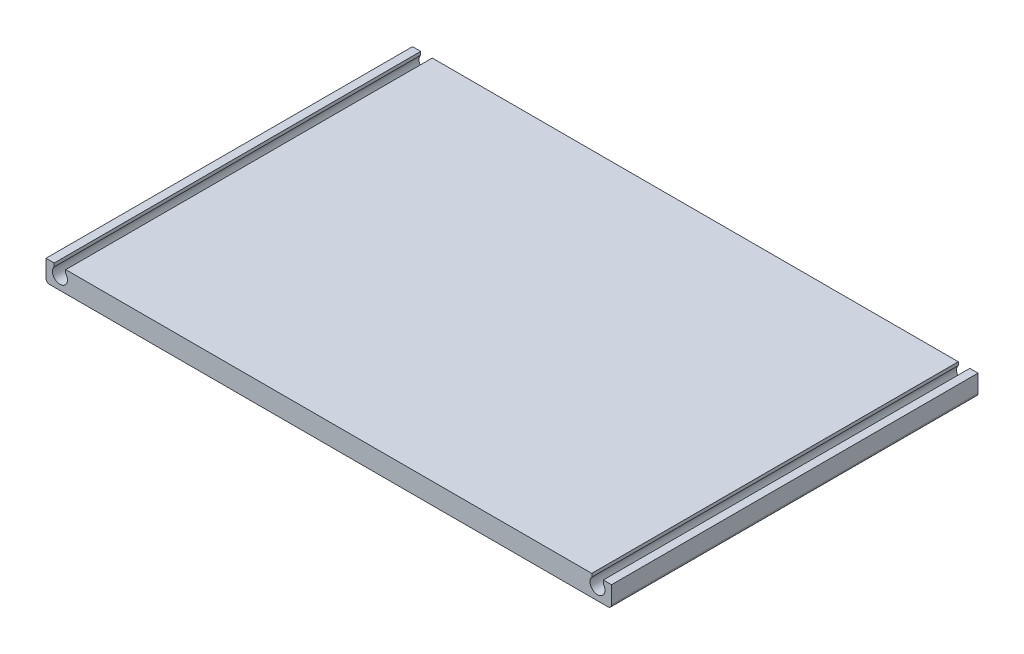
from build123d import *

# Parameters (mm, degrees)
SKETCH_1_W            = 162
SKETCH_1_H            = 105
EXTRUDE_1_DEPTH       = 6
CUT_EXTRUDE_1_DEPTH   = 133.747881339
FILLET_1_R            = 1
EXTRUDE_START         = -20
SKETCH_4_W            = 20
SKETCH_4_H            = 14.5
EXTRUDE_2_DEPTH       = 5
F_4_0MM_1_D           = 4
F_4_0MM_1_CSINK_D     = 4.05
F_4_0MM_1_CSINK_ANGLE = 90
EXTRUDE_START_2       = 15
SKETCH_7_W            = 6
SKETCH_7_H            = 9
EXTRUDE_3_DEPTH       = 20.5
SKETCH_8_R            = 1.5
CUT_EXTRUDE_2_DEPTH   = 103.13471496
CUT_EXTRUDE_3_DEPTH   = 134.402586182
EXTRUDE_START_3       = -5
SKETCH_10_W           = 20
SKETCH_10_H           = 14.5
SKETCH_10_R           = 2.025
SKETCH_10_R_2         = 2
EXTRUDE_4_DEPTH       = 5
SKETCH_12_R           = 2.1
SKETCH_12_R_2         = 2.125
SKETCH_12_R_3         = 1.6
CUT_EXTRUDE_4_DEPTH   = 134.402586182


with BuildPart() as part:
    # 草圖1 → 填料-伸長1 (new body)
    with BuildSketch(Plane(origin=(0, 0, 0), x_dir=(1, 0, 0), z_dir=(0, 1, 0))):
        Rectangle(SKETCH_1_W, SKETCH_1_H)
    extrude(amount=EXTRUDE_1_DEPTH)

    # 草圖3 → 除料-伸長1 (cut, through all)
    with BuildSketch(Plane.XY.offset(52.5)):
        with BuildLine():
            Line((75.5, 5), (75.5, 6))
            Line((75.5, 6), (78.5, 6))
            Line((78.5, 6), (78.5, 5))
            ThreePointArc((78.5, 5), (77, 1.677124344), (75.5, 5))
        make_face()
    cut_extrude_1 = extrude(amount=-CUT_EXTRUDE_1_DEPTH, mode=Mode.SUBTRACT)

    # 鏡射1: 除料-伸長1 across plane
    add(cut_extrude_1.mirror(Plane(origin=(0, 0, 0), x_dir=(0, 0, 1), z_dir=(1, 0, 0))), mode=Mode.SUBTRACT)

    # 圓角1
    fillet_1_edges = [part.edges().sort_by_distance(p)[0] for p in [
        (81, 0, 0),
        (-81, 0, 0),
    ]]
    fillet(fillet_1_edges, radius=FILLET_1_R)

    # 草圖4 → 填料-伸長2 (add)
    with BuildSketch(Plane(origin=(0, 0, -52.5), x_dir=(-1, 0, 0), z_dir=(0, 0, -1)).offset(EXTRUDE_START)):
        with Locations((0, -7.25)):
            Rectangle(SKETCH_4_W, SKETCH_4_H)
    extrude(amount=-EXTRUDE_2_DEPTH)

    # Ø4.0mm 定位孔1 (through all)
    with Locations(Plane(origin=(0, 0, -32.5), x_dir=(-1, 0, 0), z_dir=(0, 0, -1))):
        with Locations((5, -8), (-5, -8)):
            CounterSinkHole(F_4_0MM_1_D / 2, F_4_0MM_1_CSINK_D / 2, counter_sink_angle=F_4_0MM_1_CSINK_ANGLE)

    # 草圖7 → 填料-伸長3 (add)
    with BuildSketch(Plane.XY.offset(-27.5).offset(EXTRUDE_START_2)):
        with Locations((19.75, -4.5)):
            Rectangle(SKETCH_7_W, SKETCH_7_H)
        with Locations((-19.75, -4.5)):
            Rectangle(SKETCH_7_W, SKETCH_7_H)
    extrude(amount=EXTRUDE_3_DEPTH)

    # 草圖8 → 除料-伸長2 (cut, through all)
    with BuildSketch(Plane.XY.offset(8)):
        with Locations((-19.75, -6)):
            Circle(SKETCH_8_R)
        with Locations((19.75, -6)):
            Circle(SKETCH_8_R)
    extrude(amount=-CUT_EXTRUDE_2_DEPTH, mode=Mode.SUBTRACT)

    # 草圖9 → 除料-伸長3 (cut, through all)
    with BuildSketch(Plane.XY.offset(52.5)):
        with BuildLine():
            Line((-78.65, 6), (-75.35, 6))
            Line((-75.35, 6), (-75.35, 5.05552922))
            ThreePointArc((-75.35, 5.05552922), (-77, 1.527124344), (-78.65, 5.05552922))
            Line((-78.65, 5.05552922), (-78.65, 6))
        make_face()
        with BuildLine():
            Line((78.65, 5.05552922), (78.65, 6))
            Line((78.65, 6), (75.35, 6))
            Line((75.35, 6), (75.35, 5.05552922))
            ThreePointArc((75.35, 5.05552922), (77, 1.527124344), (78.65, 5.05552922))
        make_face()
    extrude(amount=-CUT_EXTRUDE_3_DEPTH, mode=Mode.SUBTRACT)

    # 草圖10 → 填料-伸長4 (add)
    # profile 1 of 2: a face of its own
    with BuildSketch(Plane(origin=(0, 0, -32.5), x_dir=(-1, 0, 0), z_dir=(0, 0, -1)).offset(EXTRUDE_START_3)):
        with Locations((0, -7.25)):
            Rectangle(SKETCH_10_W, SKETCH_10_H)
        with Locations((5, -8)):
            Circle(SKETCH_10_R, mode=Mode.SUBTRACT)
        with Locations((-5, -8)):
            Circle(SKETCH_10_R_2, mode=Mode.SUBTRACT)
    # profile 2 of 2: a face of its own
    with BuildSketch(Plane(origin=(0, 0, -32.5), x_dir=(-1, 0, 0), z_dir=(0, 0, -1)).offset(EXTRUDE_START_3)):
        with Locations((50, -7.25)):
            Rectangle(SKETCH_10_W, SKETCH_10_H)
        with Locations((55, -8)):
            Circle(SKETCH_10_R, mode=Mode.SUBTRACT)
        with Locations((45, -8)):
            Circle(SKETCH_10_R_2, mode=Mode.SUBTRACT)
    extrude(amount=EXTRUDE_4_DEPTH)

    # 草圖12 → 除料-伸長4 (cut, through all)
    with BuildSketch(Plane.XY.offset(52.5)):
        with Locations((-45, -8)):
            Circle(SKETCH_12_R)
        with Locations((-55, -8)):
            Circle(SKETCH_12_R_2)
        with Locations((-19.75, -6)):
            Circle(SKETCH_12_R_3)
        with Locations((-5, -8)):
            Circle(SKETCH_12_R)
        with Locations((5, -8)):
            Circle(SKETCH_12_R)
        with Locations(Location((19.75, -6, 0), (0, 0, 180))):
            Circle(SKETCH_12_R_3)
    extrude(amount=-CUT_EXTRUDE_4_DEPTH, mode=Mode.SUBTRACT)


solid = part.part
